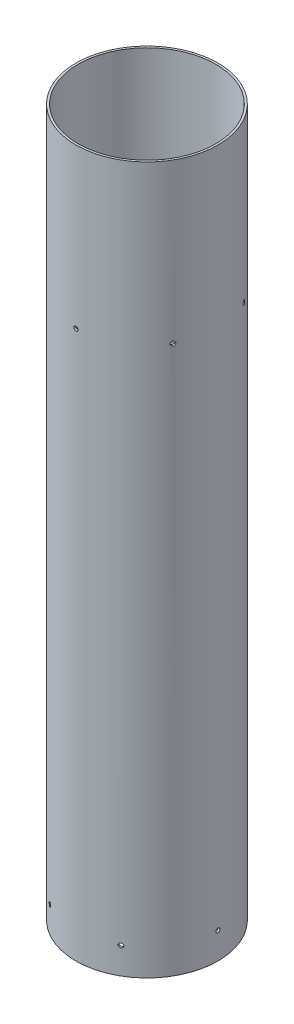
from build123d import *

# Parameters (mm, degrees)
SKETCH2_R           = 51.054
SKETCH2_R_2         = 49.53
BOSS_EXTRUDE1_DEPTH = 508
SKETCH3_R           = 1.524
CUT_EXTRUDE1_DEPTH  = 74.422
CIRPATTERN1_COUNT   = 6
SKETCH4_R           = 1.524
CUT_EXTRUDE2_DEPTH  = 74.422
CIRPATTERN2_COUNT   = 6


with BuildPart() as part:
    # Sketch2 → Boss-Extrude1 (new body)
    with BuildSketch(Plane(origin=(0, 0, 0), x_dir=(1, 0, 0), z_dir=(0, 1, 0))):
        with Locations(Location((0, 0, 0), (0, 0, 270))):
            Circle(SKETCH2_R)
        with Locations(Location((0, 0, 0), (0, 0, 270))):
            Circle(SKETCH2_R_2, mode=Mode.SUBTRACT)
    extrude(amount=BOSS_EXTRUDE1_DEPTH)

    # Sketch3 → Cut-Extrude1 (cut)
    with BuildSketch(Plane.XY):
        with Locations(Location((0, 393.7, 0), (0, 0, 90))):
            Circle(SKETCH3_R)
    cut_extrude1 = extrude(amount=-CUT_EXTRUDE1_DEPTH, mode=Mode.SUBTRACT)

    # CirPattern1: Cut-Extrude1 ×6 about axis
    cirpattern1_axis = Axis((0, 508, 0), (0, -1, 0))
    for i in range(1, CIRPATTERN1_COUNT):
        add(cut_extrude1.rotate(cirpattern1_axis, i * 360 / CIRPATTERN1_COUNT), mode=Mode.SUBTRACT)

    # Sketch4 → Cut-Extrude2 (cut)
    with BuildSketch(Plane(origin=(0, 0, 0), x_dir=(0, 0, -1), z_dir=(1, 0, 0))):
        with Locations((0, 19.05)):
            Circle(SKETCH4_R)
    cut_extrude2 = extrude(amount=-CUT_EXTRUDE2_DEPTH, mode=Mode.SUBTRACT)

    # CirPattern2: Cut-Extrude2 ×6 about axis
    cirpattern2_axis = Axis((0, 508, 0), (0, -1, 0))
    for i in range(1, CIRPATTERN2_COUNT):
        add(cut_extrude2.rotate(cirpattern2_axis, i * 360 / CIRPATTERN2_COUNT), mode=Mode.SUBTRACT)


solid = part.part
